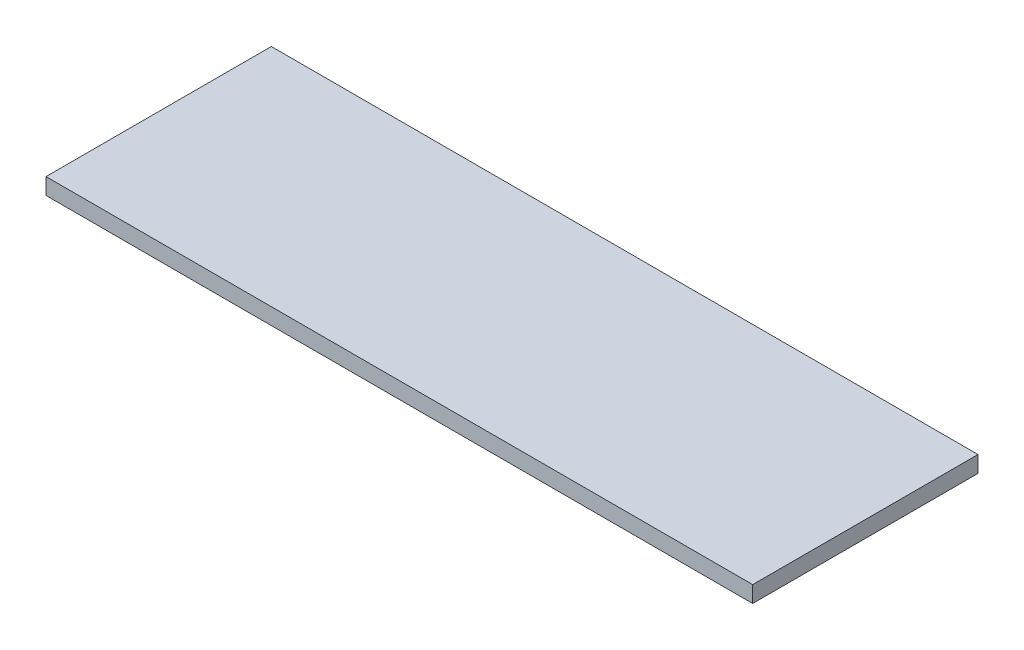
from build123d import *

# Parameters (mm, degrees)
SKETCH1_W           = 69
SKETCH1_H           = 22
BOSS_EXTRUDE1_DEPTH = 1.6


with BuildPart() as part:
    # Sketch1 → Boss-Extrude1 (new body)
    with BuildSketch(Plane(origin=(0, 0, 0), x_dir=(1, 0, 0), z_dir=(0, 1, 0))):
        with Locations((-34.5, 11)):
            Rectangle(SKETCH1_W, SKETCH1_H)
    extrude(amount=BOSS_EXTRUDE1_DEPTH)


solid = part.part
